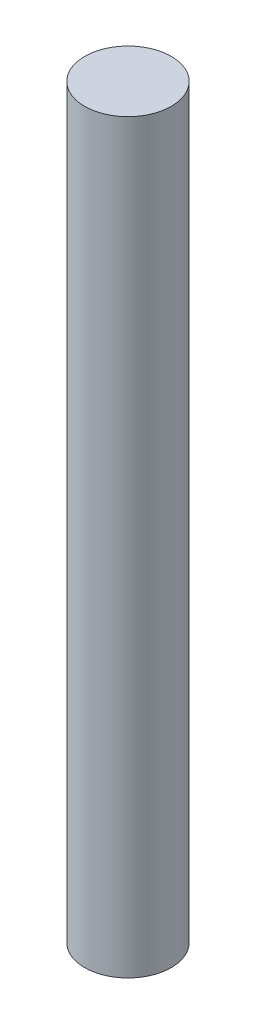
from build123d import *

# Parameters (mm, degrees)
SKETCH1_R           = 5.159375
BOSS_EXTRUDE1_DEPTH = 88.9


with BuildPart() as part:
    # Sketch1 → Boss-Extrude1 (new body)
    with BuildSketch(Plane(origin=(0, 0, 0), x_dir=(1, 0, 0), z_dir=(0, 1, 0))):
        with Locations(Location((0, 0, 0), (0, 0, 270))):
            Circle(SKETCH1_R)
    extrude(amount=BOSS_EXTRUDE1_DEPTH)


solid = part.part
